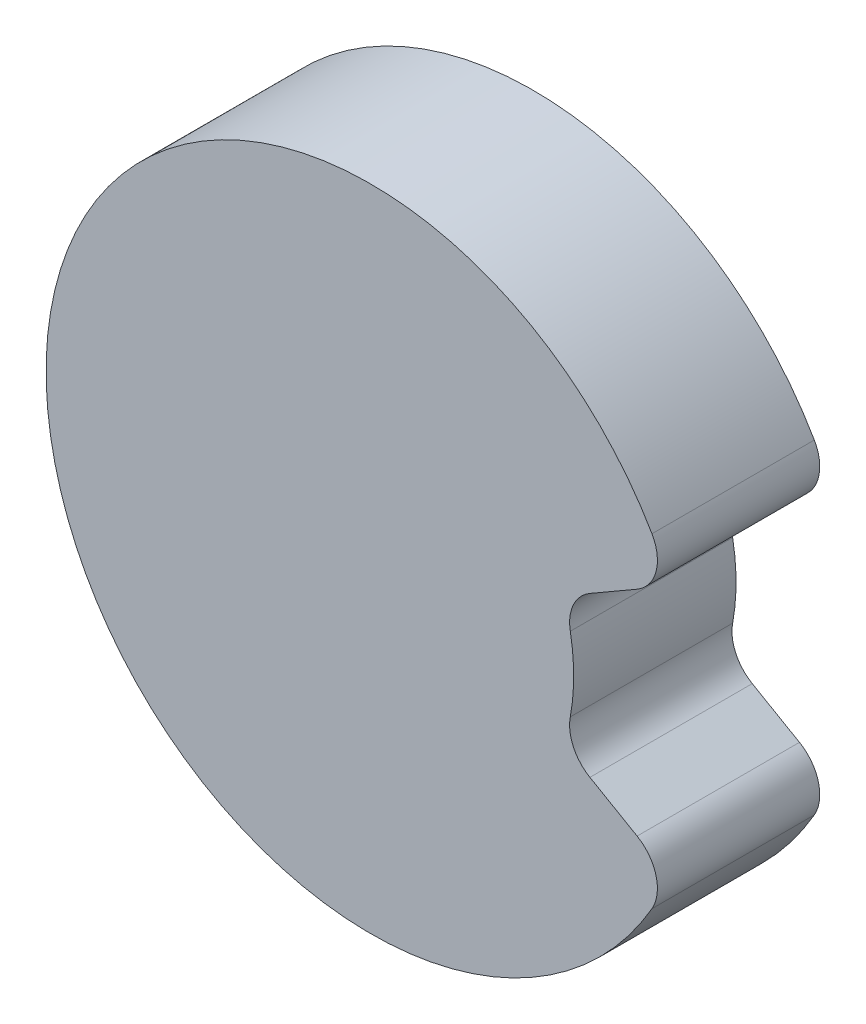
from build123d import *

# Parameters (mm, degrees)
BOSS_EXTRUDE1_DEPTH = 25.4
FILLET1_R           = 12.7


with BuildPart() as part:
    # Sketch1 → Boss-Extrude1 (new, symmetric)
    with BuildSketch(Plane(origin=(0, 0, 0), x_dir=(0, 1, 0), z_dir=(0, 0, 1))):
        with BuildLine():
            Line((-39.403039848, -93.648066989), (-20.109997105, -60.231536726))
            ThreePointArc((-20.109997105, -60.231536726), (0, -63.5), (20.109997105, -60.231536726))
            Line((20.109997105, -60.231536726), (39.403039848, -93.648066989))
            ThreePointArc((39.403039848, -93.648066989), (0, 101.6), (-39.403039848, -93.648066989))
        make_face()
    extrude(amount=BOSS_EXTRUDE1_DEPTH, both=True)

    # Fillet1
    fillet1_edges = [part.edges().sort_by_distance(p)[0] for p in [
        (60.231536726, -20.109997105, 0),
        (93.648066989, -39.403039848, 0),
        (93.648066989, 39.403039848, 0),
        (60.231536726, 20.109997105, 0),
    ]]
    fillet(fillet1_edges, radius=FILLET1_R)


solid = part.part
